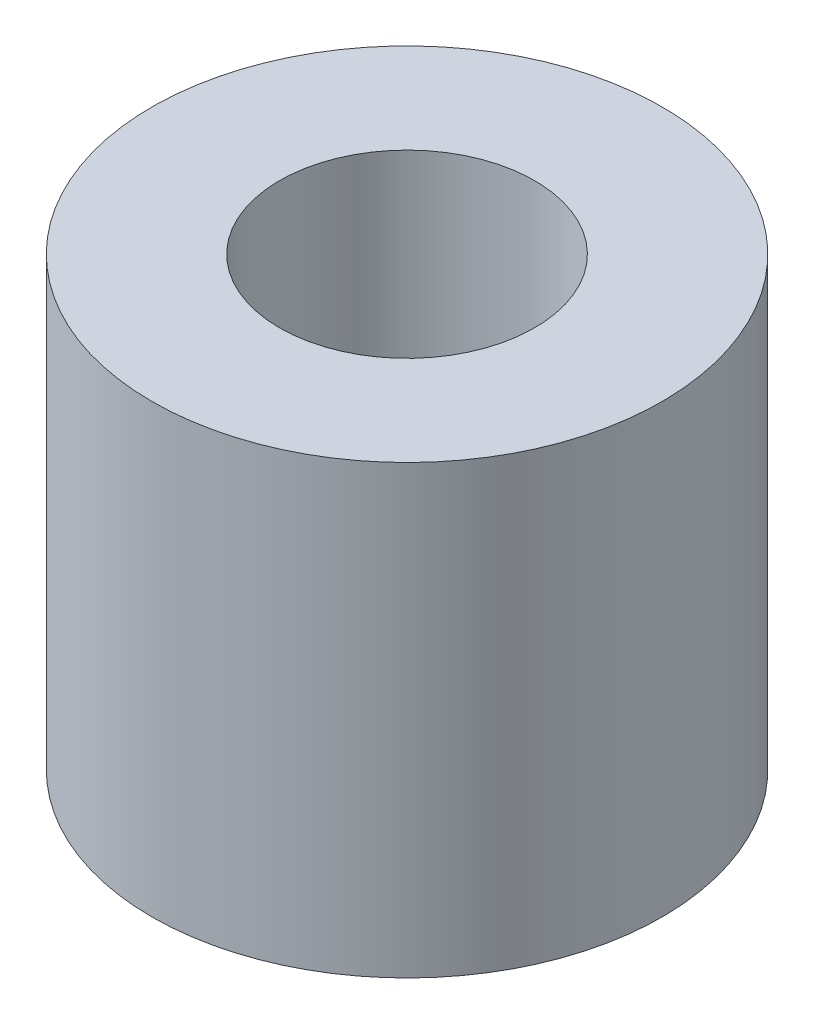
from build123d import *

# Parameters (mm, degrees)
SKETCH1_R           = 2
SKETCH1_R_2         = 1
BOSS_EXTRUDE1_DEPTH = 3.5


with BuildPart() as part:
    # Sketch1 → Boss-Extrude1 (new body)
    with BuildSketch(Plane(origin=(0, 0, 0), x_dir=(1, 0, 0), z_dir=(0, 1, 0))):
        with Locations(Location((0, 0, 0), (0, 0, 270))):
            Circle(SKETCH1_R)
        with Locations(Location((0, 0, 0), (0, 0, 270))):
            Circle(SKETCH1_R_2, mode=Mode.SUBTRACT)
    extrude(amount=BOSS_EXTRUDE1_DEPTH)


solid = part.part
